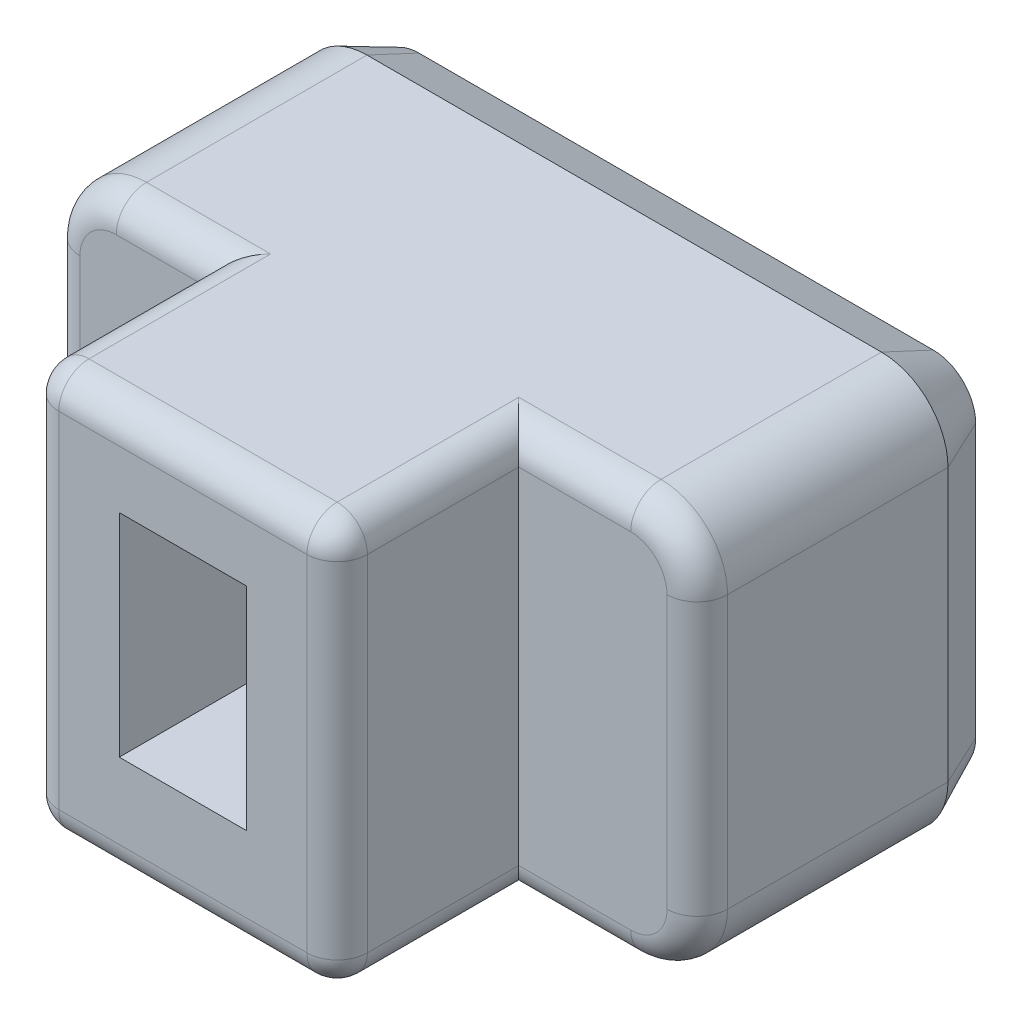
from build123d import *

# Parameters (mm, degrees)
BOSS_EXTRU_1_DEPTH      = 8
ESQUISSE3_W             = 2.1
ESQUISSE3_H             = 3.5
ENL_V_MAT_EXTRU_1_DEPTH = 3
ESQUISSE4_OUTSIDE_W     = 15.69
ESQUISSE4_OUTSIDE_H     = 11.69
ESQUISSE4_OUTSIDE_W_2   = 5.1
ESQUISSE4_OUTSIDE_H_2   = 6.7
ENL_V_MAT_EXTRU_2_DEPTH = 3
CONG_1_R                = 0.5
CHANFREIN1_SIZE         = 0.4
CHANFREIN1_SIZE2        = 0.857802768
ENL_V_MAT_EXTRU_3_DEPTH = 0.3
BOSS_EXTRU_2_START      = -0.2
BOSS_EXTRU_2_DEPTH      = 0.2
BOSS_EXTRU_2_2_DEPTH    = 0.2
BOSS_EXTRU_2_3_DEPTH    = 0.2


with BuildPart() as part:
    # Esquisse2 → Boss.-Extru.1 (new body)
    with BuildSketch(Plane.XY):
        with BuildLine():
            Line((1.1, 0), (9.6, 0))
            ThreePointArc((9.6, 0), (10.377817459, 0.322182541), (10.7, 1.1))
            Line((10.7, 1.1), (10.7, 5.6))
            ThreePointArc((10.7, 5.6), (10.377817459, 6.377817459), (9.6, 6.7))
            Line((9.6, 6.7), (1.1, 6.7))
            ThreePointArc((1.1, 6.7), (0.322182541, 6.377817459), (0, 5.6))
            Line((0, 5.6), (0, 1.1))
            ThreePointArc((0, 1.1), (0.322182541, 0.322182541), (1.1, 0))
        make_face()
    extrude(amount=BOSS_EXTRU_1_DEPTH)

    # Esquisse3 → Enlèv. mat.-Extru.1 (cut)
    with BuildSketch(Plane.XY.offset(8)):
        with Locations((5.2, 3.5)):
            Rectangle(ESQUISSE3_W, ESQUISSE3_H)
    extrude(amount=-ENL_V_MAT_EXTRU_1_DEPTH, mode=Mode.SUBTRACT)

    # Esquisse4 outside → Enlèv. mat.-Extru.2 (cut)
    with BuildSketch(Plane.XY.offset(8)):
        with Locations((5.35, 3.35)):
            Rectangle(ESQUISSE4_OUTSIDE_W, ESQUISSE4_OUTSIDE_H)
        with Locations((5.2, 3.35)):
            Rectangle(ESQUISSE4_OUTSIDE_W_2, ESQUISSE4_OUTSIDE_H_2, mode=Mode.SUBTRACT)
    extrude(amount=-ENL_V_MAT_EXTRU_2_DEPTH, mode=Mode.SUBTRACT)

    # Congé1
    cong_1_edges = [part.edges().sort_by_distance(p)[0] for p in [
        (8.675, 0, 5),
        (10.377817459, 0.322182541, 5),
        (10.7, 3.35, 5),
        (10.377817459, 6.377817459, 5),
        (1.875, 6.7, 5),
        (0.322182541, 6.377817459, 5),
        (1.875, 0, 5),
        (0.322182541, 0.322182541, 5),
        (7.75, 6.7, 6.5),
        (2.65, 6.7, 6.5),
        (7.75, 0, 6.5),
        (2.65, 0, 6.5),
        (2.65, 3.35, 8),
        (5.2, 6.7, 8),
        (7.75, 3.35, 8),
        (5.2, 0, 8),
        (8.675, 6.7, 5),
        (0, 3.35, 5),
    ]]
    fillet(cong_1_edges, radius=CONG_1_R)

    # Chanfrein1
    chanfrein1_edges = [part.edges().sort_by_distance(p)[0] for p in [
        (5.35, 0, 0),
        (10.377817459, 0.322182541, 0),
        (0.322182541, 0.322182541, 0),
        (10.7, 3.35, 0),
        (0, 3.35, 0),
        (10.377817459, 6.377817459, 0),
        (0.322182541, 6.377817459, 0),
        (5.35, 6.7, 0),
    ]]
    chanfrein1_side = [part.faces().sort_by_distance(p)[0] for p in [
        (5.35, 3.35, 0),
    ]]
    chamfer(chanfrein1_edges, length=CHANFREIN1_SIZE, length2=CHANFREIN1_SIZE2, reference=chanfrein1_side[0])

    # Esquisse5 → Enlèv. mat.-Extru.3 (cut)
    # profile 1 of 3: a face of its own
    with BuildSketch(Plane.XY.offset(0.2)):
        Polygon((3.382593084, 1.356639893), (4.715926417, 5.356639893), (4.38099052, 5.356639893), (3.953907187, 4.074588611), (2.75999693, 4.074588611), (2.332913597, 5.356639893), (1.997977699, 5.356639893), (3.331311033, 1.356639893), align=None)
        Polygon((3.356952058, 2.284524508), (2.897016161, 3.6643322), (3.816887956, 3.6643322), align=None, mode=Mode.SUBTRACT)
    # profile 2 of 3: a face of its own
    with BuildSketch(Plane.XY.offset(0.2)):
        Polygon((5.382593084, 1.356639893), (5.690285392, 1.356639893), (5.690285392, 4.946383482), (6.921054623, 4.946383482), (6.921054623, 5.356639893), (5.382593084, 5.356639893), align=None)
    # profile 3 of 3: a face of its own
    with BuildSketch(Plane.XY.offset(0.2)):
        Polygon((7.074900776, 1.766896303), (7.074900776, 1.356639893), (8.715926417, 1.356639893), (8.715926417, 1.766896303), (8.049259751, 1.766896303), (8.049259751, 5.356639893), (7.741567443, 5.356639893), (7.741567443, 1.766896303), align=None)
    extrude(amount=-ENL_V_MAT_EXTRU_3_DEPTH, mode=Mode.SUBTRACT)


with BuildPart() as body_2:
    # Esquisse5<3> → Boss.-Extru.2 (new body)
    with BuildSketch(Plane.XY.offset(0.2).offset(BOSS_EXTRU_2_START)):
        Polygon((3.382593084, 1.356639893), (4.715926417, 5.356639893), (4.38099052, 5.356639893), (3.953907187, 4.074588611), (2.75999693, 4.074588611), (2.332913597, 5.356639893), (1.997977699, 5.356639893), (3.331311033, 1.356639893), align=None)
        Polygon((3.356952058, 2.284524508), (2.897016161, 3.6643322), (3.816887956, 3.6643322), align=None, mode=Mode.SUBTRACT)
    extrude(amount=-BOSS_EXTRU_2_DEPTH)


with BuildPart() as body_3:
    # Esquisse5<3> → Boss.-Extru.2 2 (new body)
    with BuildSketch(Plane.XY.offset(0.2).offset(BOSS_EXTRU_2_START)):
        Polygon((5.382593084, 1.356639893), (5.690285392, 1.356639893), (5.690285392, 4.946383482), (6.921054623, 4.946383482), (6.921054623, 5.356639893), (5.382593084, 5.356639893), align=None)
    extrude(amount=-BOSS_EXTRU_2_2_DEPTH)


with BuildPart() as body_4:
    # Esquisse5<3> → Boss.-Extru.2 3 (new body)
    with BuildSketch(Plane.XY.offset(0.2).offset(BOSS_EXTRU_2_START)):
        Polygon((7.074900776, 1.766896303), (7.074900776, 1.356639893), (8.715926417, 1.356639893), (8.715926417, 1.766896303), (8.049259751, 1.766896303), (8.049259751, 5.356639893), (7.741567443, 5.356639893), (7.741567443, 1.766896303), align=None)
    extrude(amount=-BOSS_EXTRU_2_3_DEPTH)


solid = Compound([part.part, body_2.part, body_3.part, body_4.part])
